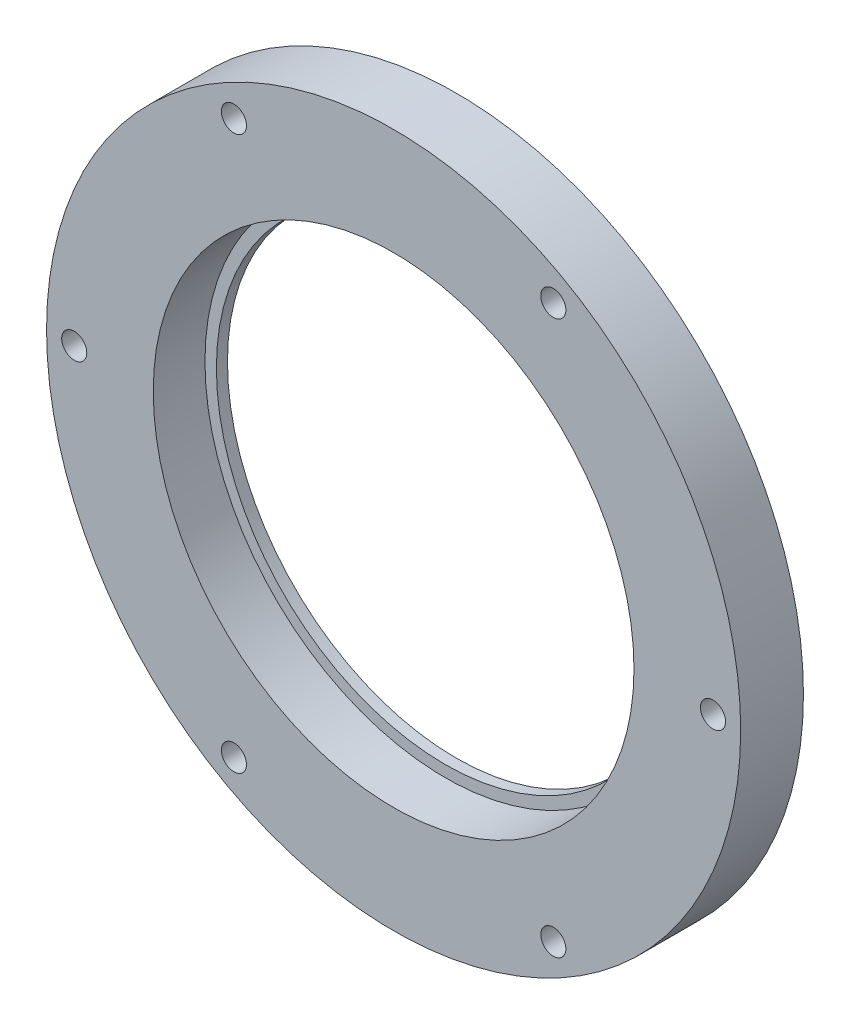
from build123d import *

# Parameters (mm, degrees)
SKETCH1_R           = 47
BOSS_EXTRUDE2_DEPTH = 8.5
SKETCH2_R           = 32.55
CUT_EXTRUDE1_DEPTH  = 7
SKETCH3_R           = 31
BRAIN_DEPTH         = 67.835619246
SKETCH4_R           = 1.7
SCREW_HOLES_DEPTH   = 68.009327709


with BuildPart() as part:
    # Sketch1 → Boss-Extrude2 (new body)
    with BuildSketch(Plane.XY):
        Circle(SKETCH1_R)
    extrude(amount=BOSS_EXTRUDE2_DEPTH)

    # Sketch2 → Cut-Extrude1 (cut)
    with BuildSketch(Plane.XY.offset(8.5)):
        Circle(SKETCH2_R)
    extrude(amount=-CUT_EXTRUDE1_DEPTH, mode=Mode.SUBTRACT)

    # Sketch3 → Brain (cut, through all)
    with BuildSketch(Plane.XY.offset(1.5)):
        Circle(SKETCH3_R)
    extrude(amount=-BRAIN_DEPTH, mode=Mode.SUBTRACT)

    # Sketch4 → Screw Holes (cut, through all)
    with BuildSketch(Plane.XY):
        with Locations((-43.25, 0)):
            Circle(SKETCH4_R)
        with Locations((-21.625, 37.455598714)):
            Circle(SKETCH4_R)
        with Locations((21.625, 37.455598714)):
            Circle(SKETCH4_R)
        with Locations((43.25, 0)):
            Circle(SKETCH4_R)
        with Locations((21.625, -37.455598714)):
            Circle(SKETCH4_R)
        with Locations((-21.625, -37.455598714)):
            Circle(SKETCH4_R)
    extrude(amount=SCREW_HOLES_DEPTH, mode=Mode.SUBTRACT)


solid = part.part
